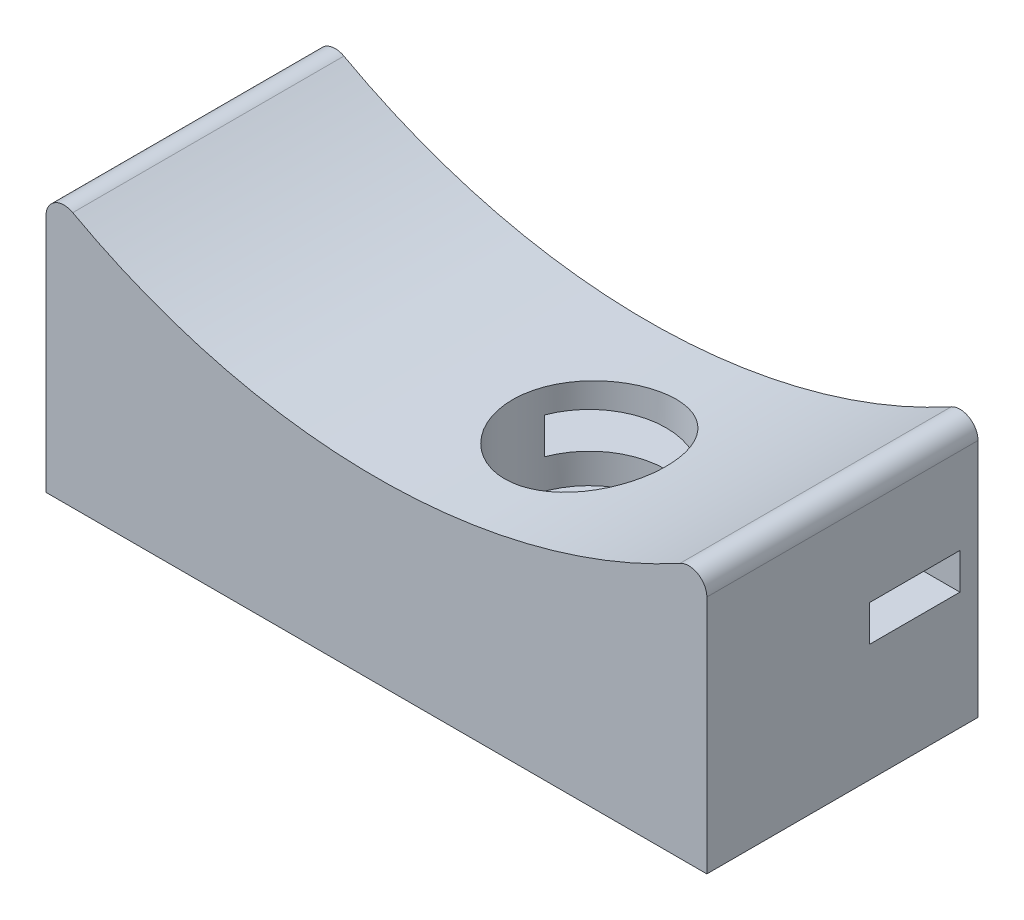
from build123d import *

# Parameters (mm, degrees)
BOSS_EXTRUDE2_DEPTH = 15
SKETCH4_R           = 2.5
CUT_EXTRUDE1_DEPTH  = 15
SKETCH5_R           = 4.25
CUT_EXTRUDE6_DEPTH  = 5
SKETCH6_W           = 5
SKETCH6_H           = 2
CUT_EXTRUDE7_DEPTH  = 43.267768571
FILLET1_R           = 1


with BuildPart() as part:
    # Sketch2 → Boss-Extrude2 (new body)
    with BuildSketch(Plane.XY):
        with BuildLine():
            Line((0, 15), (0, 0))
            Line((0, 0), (36.559051501, 0))
            Line((36.559051501, 0), (36.559051501, 15))
            ThreePointArc((36.559051501, 15), (18.27952575, 9.847260148), (0, 15))
        make_face()
    extrude(amount=BOSS_EXTRUDE2_DEPTH)

    # Sketch4 → Cut-Extrude1 (cut)
    with BuildSketch(Plane.XZ):
        with Locations(Location((22.559051501, 7.5, 0), (0, 0, 270))):
            Circle(SKETCH4_R)
    extrude(amount=-CUT_EXTRUDE1_DEPTH, mode=Mode.SUBTRACT)

    # Sketch5 → Cut-Extrude6 (cut, symmetric)
    with BuildSketch(Plane(origin=(0, 9.847260148, 0), x_dir=(1, 0, 0), z_dir=(0, 1, 0))):
        with Locations(Location((22.559051501, -7.5, 0), (0, 0, 270))):
            Circle(SKETCH5_R)
    extrude(amount=CUT_EXTRUDE6_DEPTH, both=True, mode=Mode.SUBTRACT)

    # Sketch6 → Cut-Extrude7 (cut, through all)
    with BuildSketch(Plane(origin=(36.559051501, 0, 0), x_dir=(0, 0, -1), z_dir=(1, 0, 0))):
        with Locations((-3.5, 7.5)):
            Rectangle(SKETCH6_W, SKETCH6_H)
    extrude(amount=-CUT_EXTRUDE7_DEPTH, mode=Mode.SUBTRACT)

    # Fillet1
    fillet1_edges = [part.edges().sort_by_distance(p)[0] for p in [
        (0, 15, 7.5),
        (36.559051501, 15, 7.5),
    ]]
    fillet(fillet1_edges, radius=FILLET1_R)


solid = part.part
